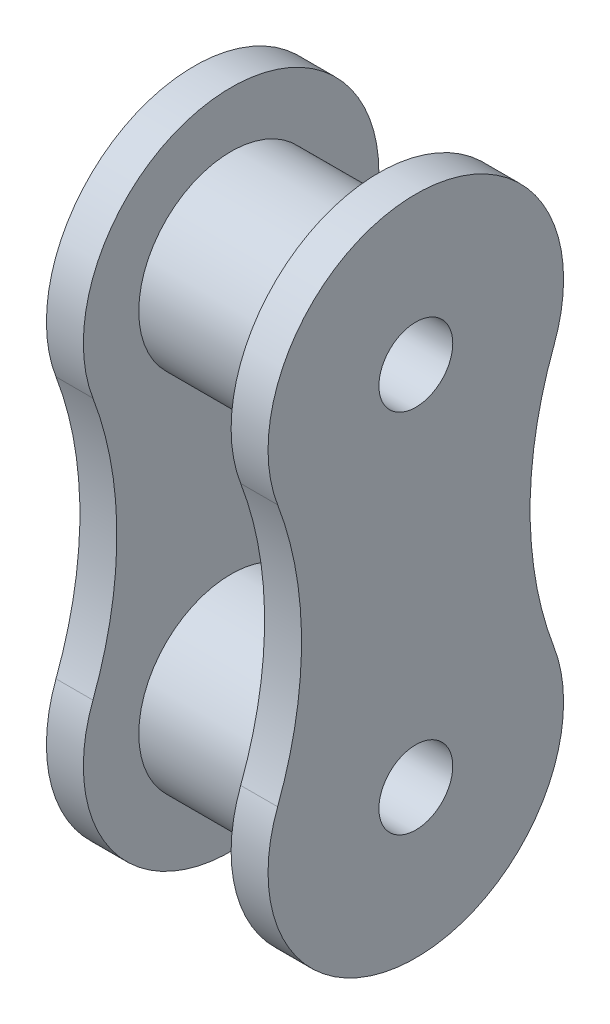
from build123d import *

# Parameters (mm, degrees)
SKETCH1_R             = 2.5
BOSS_EXTRUDE1_DEPTH   = 2.5
BOSS_EXTRUDE1_2_DEPTH = 2.5
SKETCH2_R             = 4
SKETCH2_R_2           = 2.5
BOSS_EXTRUDE2_DEPTH   = 0.5
SKETCH3_R             = 1
CUT_EXTRUDE1_DEPTH    = 12.497479072


with BuildPart() as part:
    # Sketch1 → Boss-Extrude1 (new, symmetric)
    with BuildSketch(Plane.YZ):
        with Locations(Location((-4.955, 0, 0), (0, 0, 270))):
            Circle(SKETCH1_R)
    extrude(amount=BOSS_EXTRUDE1_DEPTH, both=True)



with BuildPart() as body_2:
    # Sketch1 → Boss-Extrude1 2 (new, symmetric)
    with BuildSketch(Plane.YZ):
        with Locations(Location((4.955, 0, 0), (0, 0, 90))):
            Circle(SKETCH1_R)
    extrude(amount=BOSS_EXTRUDE1_2_DEPTH, both=True)


with BuildPart() as part_1:
    add(part.part)

    add(body_2.part)  # Boss-Extrude2 merges body 2
    # Sketch2 → Boss-Extrude2 (add, symmetric)
    # profile 1 of 4: a face of its own
    with BuildSketch(Plane.YZ.offset(2.5)):
        with Locations((-4.955, 0)):
            Circle(SKETCH2_R)
    # profile 2 of 4: a face of its own
    with BuildSketch(Plane.YZ.offset(2.5)):
        with BuildLine():
            ThreePointArc((-3.539285714, 3.741089823), (-1.663886424, 2.273449236), (-0.955, 0))
            ThreePointArc((-0.955, 0), (-1.663886424, -2.273449236), (-3.539285714, -3.741089823))
            ThreePointArc((-3.539285714, -3.741089823), (0, -3.093814379), (3.539285714, -3.741089823))
            ThreePointArc((3.539285714, -3.741089823), (0.955, 0), (3.539285714, 3.741089823))
            ThreePointArc((3.539285714, 3.741089823), (0, 3.093814379), (-3.539285714, 3.741089823))
        make_face()
    # profile 3 of 4: a face of its own
    with BuildSketch(Plane.YZ.offset(2.5)):
        with Locations((4.955, 0)):
            Circle(SKETCH2_R)
        with Locations(Location((4.955, 0, 0), (0, 0, 90))):
            Circle(SKETCH2_R_2, mode=Mode.SUBTRACT)
    # profile 4 of 4: a face of its own
    with BuildSketch(Plane.YZ.offset(2.5)):
        with Locations(Location((4.955, 0, 0), (0, 0, 90))):
            Circle(SKETCH2_R_2)
    boss_extrude2 = extrude(amount=BOSS_EXTRUDE2_DEPTH, both=True)

    # Mirror1: Boss-Extrude2 across plane
    add(boss_extrude2.mirror(Plane(origin=(0, 0, 0), x_dir=(0, 0, 1), z_dir=(1, 0, 0))))

    # Sketch3 → Cut-Extrude1 (cut, through all)
    with BuildSketch(Plane.YZ.offset(3)):
        with Locations(Location((-4.955, 0, 0), (0, 0, 270))):
            Circle(SKETCH3_R)
        with Locations(Location((4.955, 0, 0), (0, 0, 270))):
            Circle(SKETCH3_R)
    extrude(amount=-CUT_EXTRUDE1_DEPTH, mode=Mode.SUBTRACT)


solid = part_1.part
